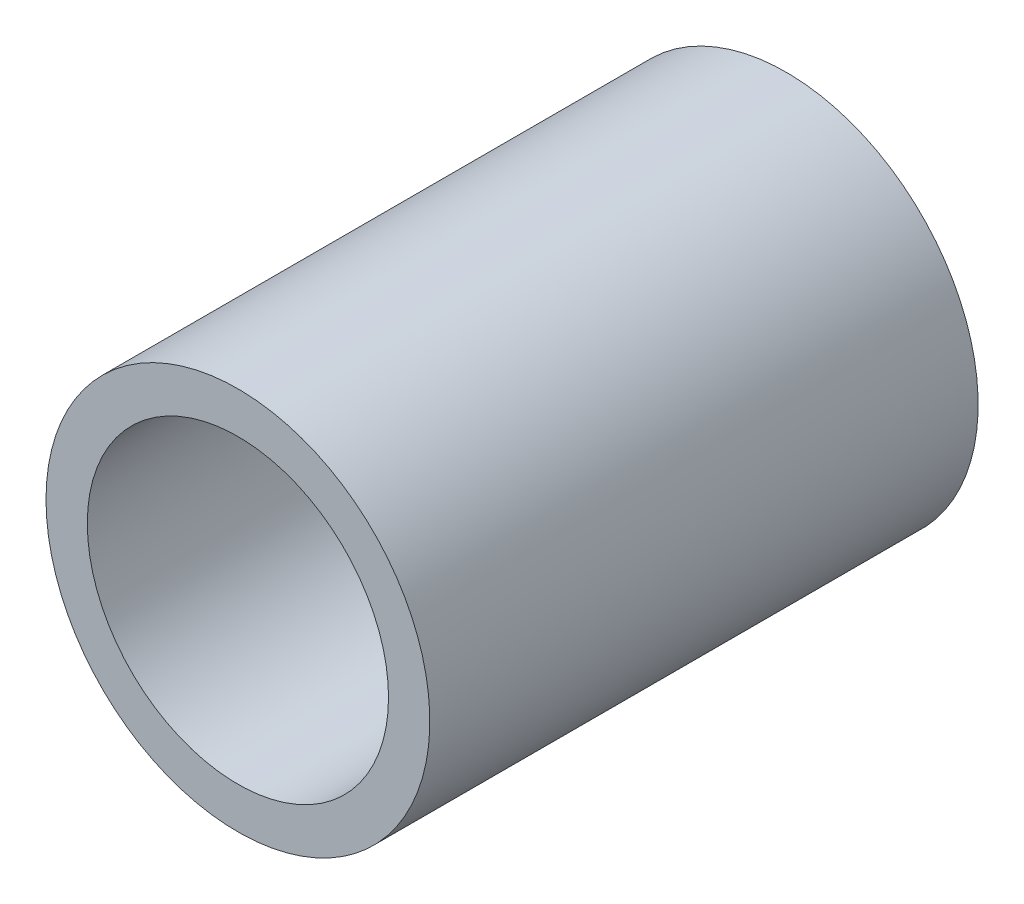
from build123d import *

# Parameters (mm, degrees)
SKETCH1_R           = 13.335
SKETCH1_R_2         = 10.4648
BOSS_EXTRUDE1_DEPTH = 38.1


with BuildPart() as part:
    # Sketch1 → Boss-Extrude1 (new body)
    with BuildSketch(Plane.XY):
        with Locations(Location((0, 0, 0), (0, 0, 180))):
            Circle(SKETCH1_R)
        with Locations(Location((0, 0, 0), (0, 0, 180))):
            Circle(SKETCH1_R_2, mode=Mode.SUBTRACT)
    extrude(amount=BOSS_EXTRUDE1_DEPTH)


solid = part.part
